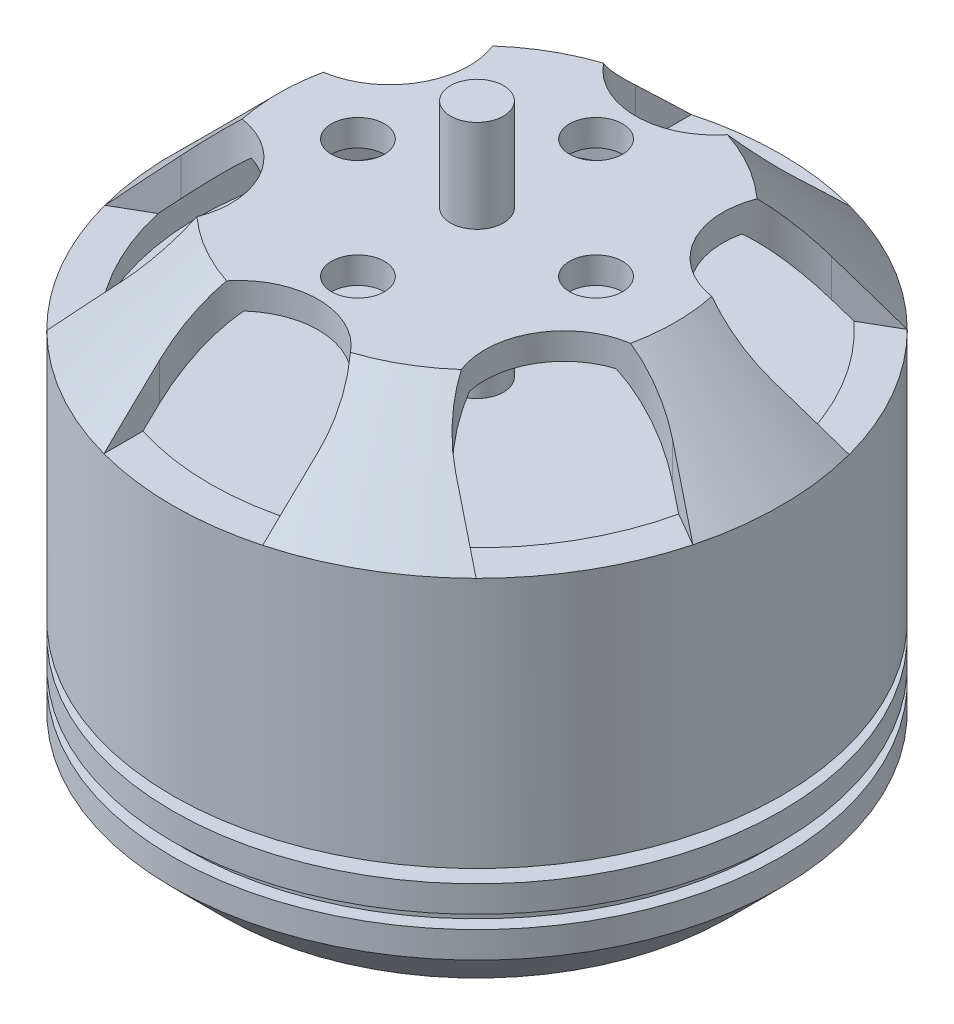
from build123d import *

# Parameters (mm, degrees)
SKETCH_2_R          = 1
CUT_EXTRUDE_1_DEPTH = 4
SKETCH_3_R          = 1
CUT_EXTRUDE_2_DEPTH = 3


with BuildPart() as part:
    # 草图1 → 旋转1 (revolve)
    with BuildSketch(Plane.XY, mode=Mode.PRIVATE) as revolve_1_sk:
        Polygon((0, 19.290656643), (0, 0), (0, -4.509343357), (1, -4.509343357), (1, -2.709343357), (9.5, -2.709343357), (11.5, -0.709343357), (11.5, 0.290656643), (11, 0.290656643), (11, 0.790656643), (11.5, 0.790656643), (11.5, 1.790656643), (9.5, 1.790656643), (9.5, 2.290656643), (11.5, 2.290656643), (11.5, 11.790656643), (7.5, 15.790656643), (1, 15.790656643), (1, 19.290656643), align=None)
        Polygon((2, 14.790656643), (7.085786438, 14.790656643), (10.5, 11.376443081), (10.5, 10.251588649), (1, 10.251588649), (1, 13.790656643), (2, 13.790656643), align=None, mode=Mode.SUBTRACT)
    revolve(revolve_1_sk.sketch.rotate(Axis((0, 19.290656643, 0), (0, -1, 0)), 90), axis=Axis((0, 19.290656643, 0), (0, -1, 0)))

    # 草图2 → 切除-拉伸1 (cut)
    with BuildSketch(Plane(origin=(0, 15.790656643, 0), x_dir=(1, 0, 0), z_dir=(0, 1, 0))):
        with Locations(Location((0, -4.5, 0), (0, 0, 270))):
            Circle(SKETCH_2_R)
        with Locations(Location((-4.5, 0, 0), (0, 0, 270))):
            Circle(SKETCH_2_R)
        with Locations(Location((0, 4.5, 0), (0, 0, 270))):
            Circle(SKETCH_2_R)
        with Locations(Location((4.5, 0, 0), (0, 0, 270))):
            Circle(SKETCH_2_R)
        with BuildLine():
            Line((-3, 9), (-3, 16.559368986))
            Line((-3, 16.559368986), (3, 16.559368986))
            Line((3, 16.559368986), (3, 9))
            ThreePointArc((3, 9), (0, 6), (-3, 9))
        make_face()
        with BuildLine():
            Line((15.840834213, 5.681608282), (12.840834213, 10.877760704))
            Line((12.840834213, 10.877760704), (6.294228634, 7.098076211))
            ThreePointArc((6.294228634, 7.098076211), (5.196152423, 3), (9.294228634, 1.901923789))
            Line((9.294228634, 1.901923789), (15.840834213, 5.681608282))
        make_face()
        with BuildLine():
            Line((12.840834213, -10.877760704), (15.840834213, -5.681608282))
            Line((15.840834213, -5.681608282), (9.294228634, -1.901923789))
            ThreePointArc((9.294228634, -1.901923789), (5.196152423, -3), (6.294228634, -7.098076211))
            Line((6.294228634, -7.098076211), (12.840834213, -10.877760704))
        make_face()
        with BuildLine():
            Line((-3, -16.559368986), (3, -16.559368986))
            Line((3, -16.559368986), (3, -9))
            ThreePointArc((3, -9), (0, -6), (-3, -9))
            Line((-3, -9), (-3, -16.559368986))
        make_face()
        with BuildLine():
            Line((-15.840834213, -5.681608282), (-12.840834213, -10.877760704))
            Line((-12.840834213, -10.877760704), (-6.294228634, -7.098076211))
            ThreePointArc((-6.294228634, -7.098076211), (-5.196152423, -3), (-9.294228634, -1.901923789))
            Line((-9.294228634, -1.901923789), (-15.840834213, -5.681608282))
        make_face()
        with BuildLine():
            Line((-12.840834213, 10.877760704), (-15.840834213, 5.681608282))
            Line((-15.840834213, 5.681608282), (-9.294228634, 1.901923789))
            ThreePointArc((-9.294228634, 1.901923789), (-5.196152423, 3), (-6.294228634, 7.098076211))
            Line((-6.294228634, 7.098076211), (-12.840834213, 10.877760704))
        make_face()
    extrude(amount=-CUT_EXTRUDE_1_DEPTH, mode=Mode.SUBTRACT)

    # 草图3 → 切除-拉伸2 (cut)
    with BuildSketch(Plane.XZ.offset(2.709343357)):
        with Locations(Location((0, 6, 0), (0, 0, 270))):
            Circle(SKETCH_3_R)
        with Locations(Location((0, -6, 0), (0, 0, 270))):
            Circle(SKETCH_3_R)
        with Locations(Location((-8, 0, 0), (0, 0, 270))):
            Circle(SKETCH_3_R)
        with Locations(Location((8, 0, 0), (0, 0, 270))):
            Circle(SKETCH_3_R)
    extrude(amount=-CUT_EXTRUDE_2_DEPTH, mode=Mode.SUBTRACT)


solid = part.part
